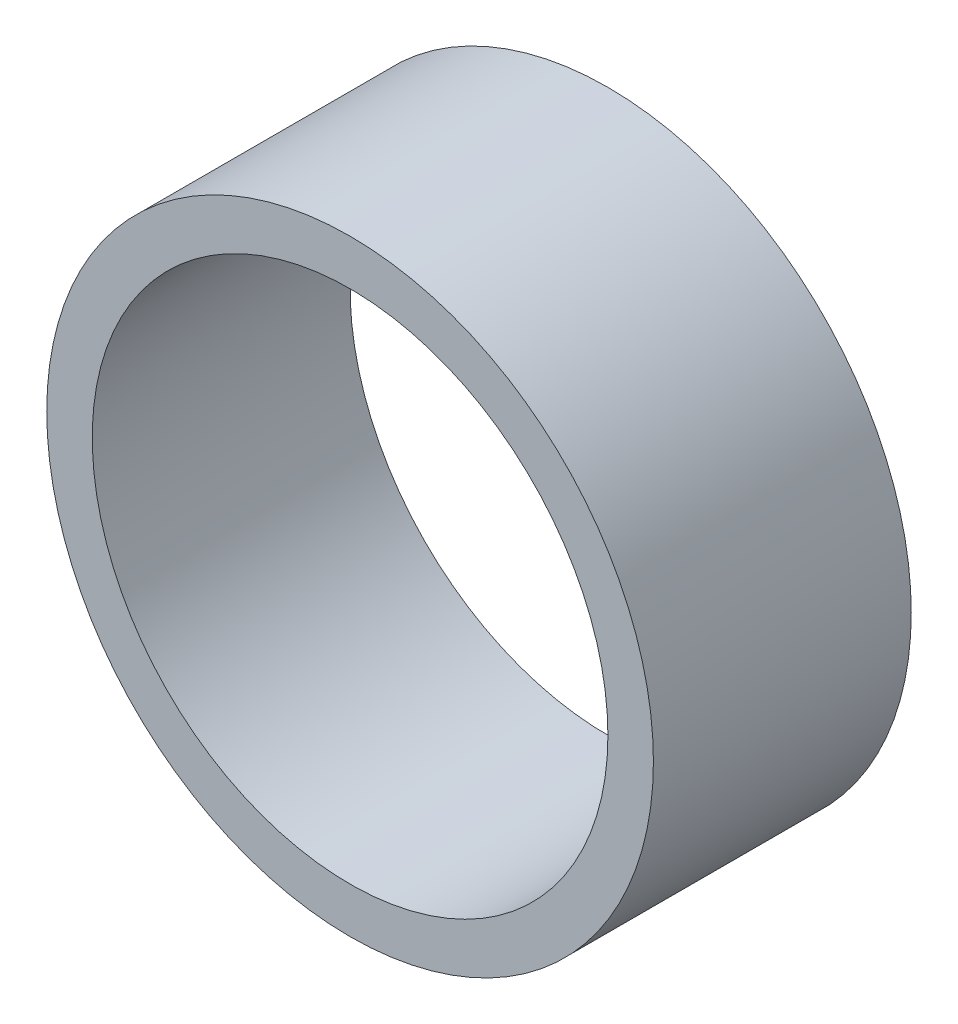
from build123d import *

# Parameters (mm, degrees)
SCHIZZO1_R                   = 50
SCHIZZO1_R_2                 = 42.5
ESTRUSIONE_ESTRUSIONE1_DEPTH = 42.5


with BuildPart() as part:
    # Schizzo1 → Estrusione-Estrusione1 (new body)
    with BuildSketch(Plane.XY):
        Circle(SCHIZZO1_R)
        Circle(SCHIZZO1_R_2, mode=Mode.SUBTRACT)
    extrude(amount=ESTRUSIONE_ESTRUSIONE1_DEPTH)


solid = part.part
